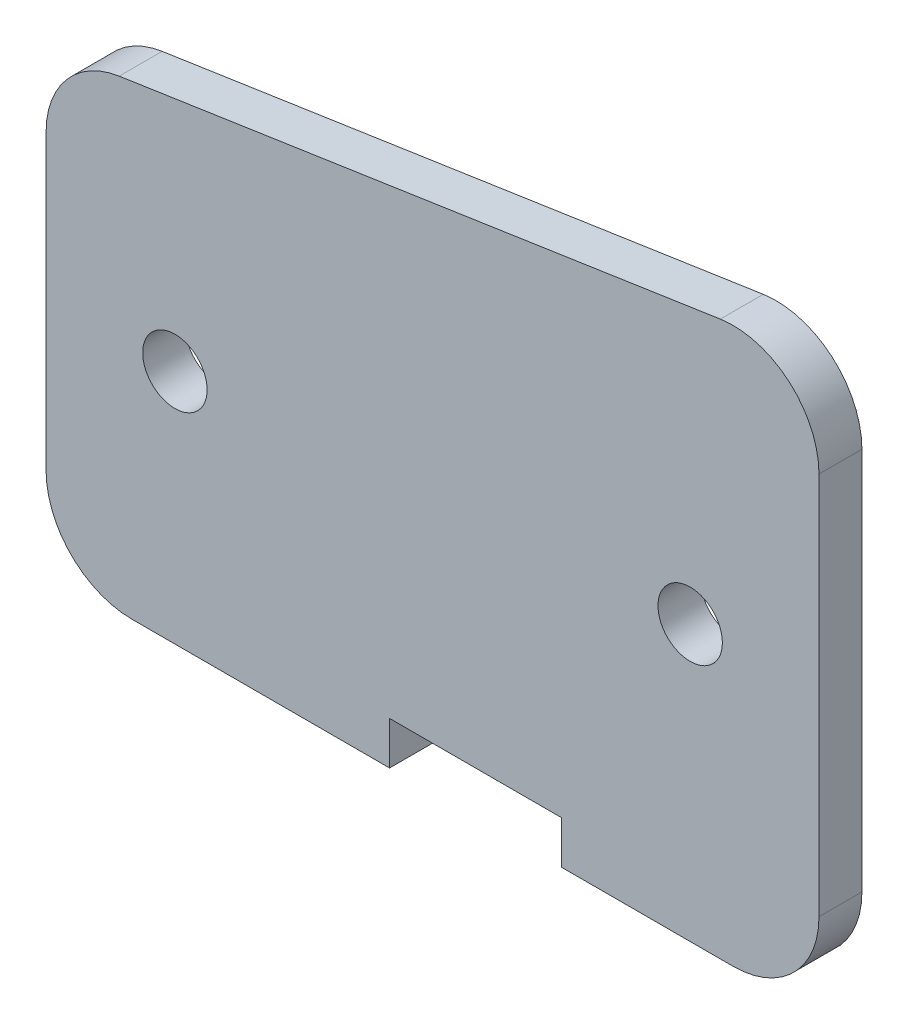
from build123d import *

# Parameters (mm, degrees)
SKETCH1_R           = 2.38125
BOSS_EXTRUDE1_DEPTH = 3.175


with BuildPart() as part:
    # Sketch1 → Boss-Extrude1 (new body)
    with BuildSketch(Plane.XY):
        with BuildLine():
            Line((-174.625, 0), (-193.675, 0))
            ThreePointArc((-193.675, 0), (-198.165128061, 1.859871939), (-200.025, 6.35))
            Line((-200.025, 6.35), (-200.025, 28.027709878))
            ThreePointArc((-200.025, 28.027709878), (-198.486650336, 32.171442621), (-194.616961876, 34.307455719))
            Line((-194.616961876, 34.307455719), (-150.166961876, 40.974955719))
            ThreePointArc((-150.166961876, 40.974955719), (-145.081267257, 39.506860214), (-142.875, 34.695209878))
            Line((-142.875, 34.695209878), (-142.875, 6.35))
            ThreePointArc((-142.875, 6.35), (-144.734871939, 1.859871939), (-149.225, 0))
            Line((-149.225, 0), (-161.925, 0))
            Line((-161.925, 0), (-161.925, 3.175))
            Line((-161.925, 3.175), (-174.625, 3.175))
            Line((-174.625, 3.175), (-174.625, 0))
        make_face()
        with Locations((-190.5, 17.4625)):
            Circle(SKETCH1_R, mode=Mode.SUBTRACT)
        with Locations((-152.4, 20.32)):
            Circle(SKETCH1_R, mode=Mode.SUBTRACT)
    extrude(amount=BOSS_EXTRUDE1_DEPTH)


solid = part.part
